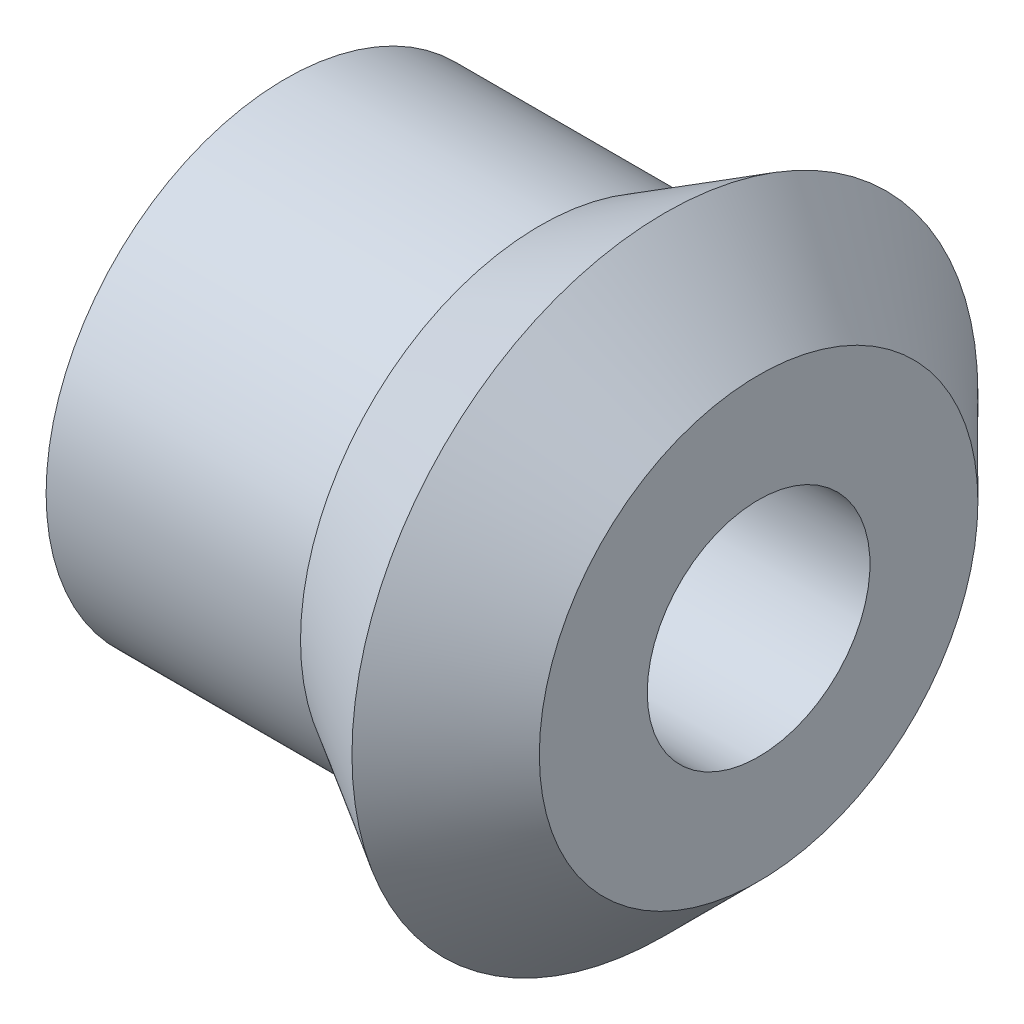
from build123d import *


with BuildPart() as part:
    # Sketch1 → Revolve1 (revolve)
    with BuildSketch(Plane.XY, mode=Mode.PRIVATE) as revolve1_sk:
        Polygon((1.588261506, 4.775), (-0.451738494, 6.815), (-3.171738494, 5.215), (-8.711738494, 5.215), (-8.711738494, 2.425), (1.588261506, 2.425), align=None)
    revolve(revolve1_sk.sketch.rotate(Axis((-22.261648433, 0, 0), (1, 0, 0)), 90), axis=Axis((-22.261648433, 0, 0), (1, 0, 0)))


solid = part.part
